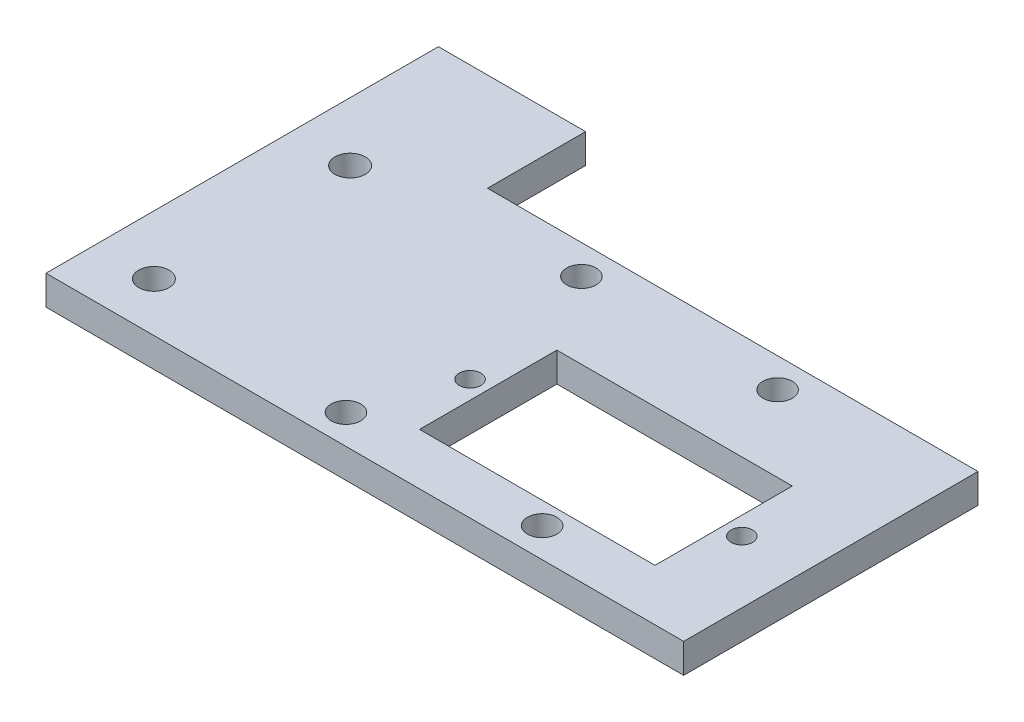
from build123d import *

# Parameters (mm, degrees)
SKETCH_1_W          = 65
SKETCH_1_H          = 40
EXTRUDE_1_DEPTH     = 3
SKETCH_2_R          = 1.55
CUT_EXTRUDE_1_DEPTH = 10
SKETCH_3_W          = 50
SKETCH_3_H          = 10
CUT_EXTRUDE_2_DEPTH = 10
SKETCH_4_W          = 24
SKETCH_4_H          = 14
CUT_EXTRUDE_3_DEPTH = 10
SKETCH_5_R          = 1.1
CUT_EXTRUDE_4_DEPTH = 10
SKETCH_6_R          = 1.5
CUT_EXTRUDE_5_DEPTH = 25


with BuildPart() as part:
    # 草图1 → 凸台-拉伸1 (new body)
    with BuildSketch(Plane(origin=(0, 0, 0), x_dir=(1, 0, 0), z_dir=(0, 1, 0))):
        Rectangle(SKETCH_1_W, SKETCH_1_H)
    extrude(amount=EXTRUDE_1_DEPTH)

    # 草图2 → 切除-拉伸1 (cut)
    with BuildSketch(Plane(origin=(0, 0, 0), x_dir=(-1, 0, 0), z_dir=(0, -1, 0))):
        with Locations(Location((26.5, -15, 0), (0, 0, 90))):
            Circle(SKETCH_2_R)
        with Locations(Location((26.5, 5, 0), (0, 0, 90))):
            Circle(SKETCH_2_R)
    extrude(amount=-CUT_EXTRUDE_1_DEPTH, mode=Mode.SUBTRACT)

    # 草图3 → 切除-拉伸2 (cut)
    with BuildSketch(Plane(origin=(0, 0, 0), x_dir=(-1, 0, 0), z_dir=(0, -1, 0))):
        with Locations((-7.5, 15)):
            Rectangle(SKETCH_3_W, SKETCH_3_H)
    extrude(amount=-CUT_EXTRUDE_2_DEPTH, mode=Mode.SUBTRACT)

    # 草图4 → 切除-拉伸3 (cut)
    with BuildSketch(Plane(origin=(0, 0, 0), x_dir=(-1, 0, 0), z_dir=(0, -1, 0))):
        with Locations((-12.32495, -7.75)):
            Rectangle(SKETCH_4_W, SKETCH_4_H)
    extrude(amount=-CUT_EXTRUDE_3_DEPTH, mode=Mode.SUBTRACT)

    # 草图5 → 切除-拉伸4 (cut)
    with BuildSketch(Plane(origin=(0, 3, 0), x_dir=(1, 0, 0), z_dir=(0, 1, 0))):
        with Locations(Location((26.17495, -7.75, 0), (0, 0, 270))):
            Circle(SKETCH_5_R)
        with Locations(Location((-1.52505, -7.75, 0), (0, 0, 270))):
            Circle(SKETCH_5_R)
    extrude(amount=-CUT_EXTRUDE_4_DEPTH, mode=Mode.SUBTRACT)

    # 草图6 → 切除-拉伸5 (cut)
    with BuildSketch(Plane(origin=(0, 0, 0), x_dir=(-1, 0, 0), z_dir=(0, -1, 0))):
        with Locations(Location((-15.074975, -17, 0), (0, 0, 90))):
            Circle(SKETCH_6_R)
        with Locations(Location((4.925025, -17, 0), (0, 0, 90))):
            Circle(SKETCH_6_R)
        with Locations(Location((-15.074975, 7, 0), (0, 0, 90))):
            Circle(SKETCH_6_R)
        with Locations(Location((4.925025, 7, 0), (0, 0, 90))):
            Circle(SKETCH_6_R)
    extrude(amount=-CUT_EXTRUDE_5_DEPTH, mode=Mode.SUBTRACT)


solid = part.part
